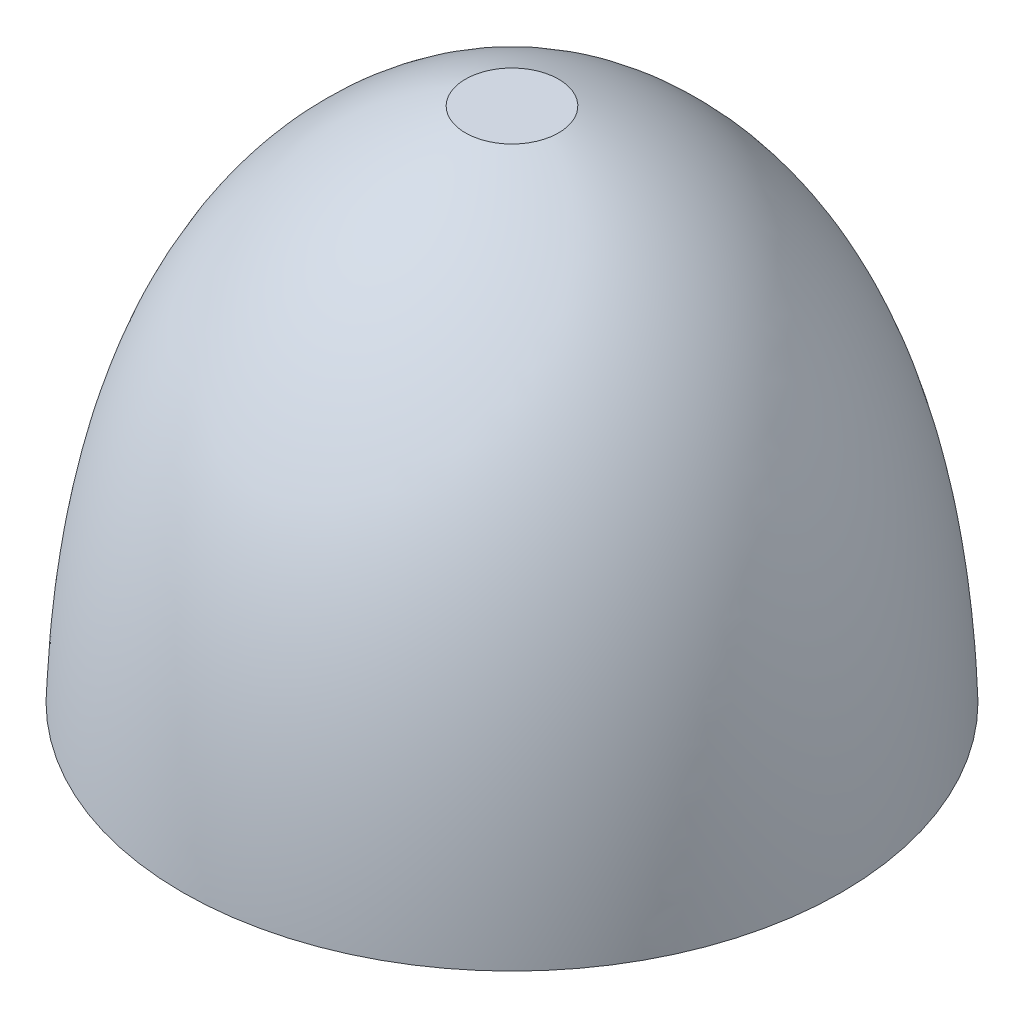
from build123d import *


with BuildPart() as part:
    # Sketch2 → Revolve1 (revolve)
    with BuildSketch(Plane.XY):
        with BuildLine():
            Line((0, 0), (0, 235))
            Line((0, 235), (21.200857963, 235))
            add(Edge.make_bspline(
                [(150, 0), (143.307610186, 192.957297178), (21.200857963, 235)],
                knots=[0, 0, 0, 0.876123487, 0.876123487, 0.876123487], degree=2))
            Line((150, 0), (0, 0))
        make_face()
    revolve(axis=Axis((0, 0, 0), (0, 1, 0)))


solid = part.part
